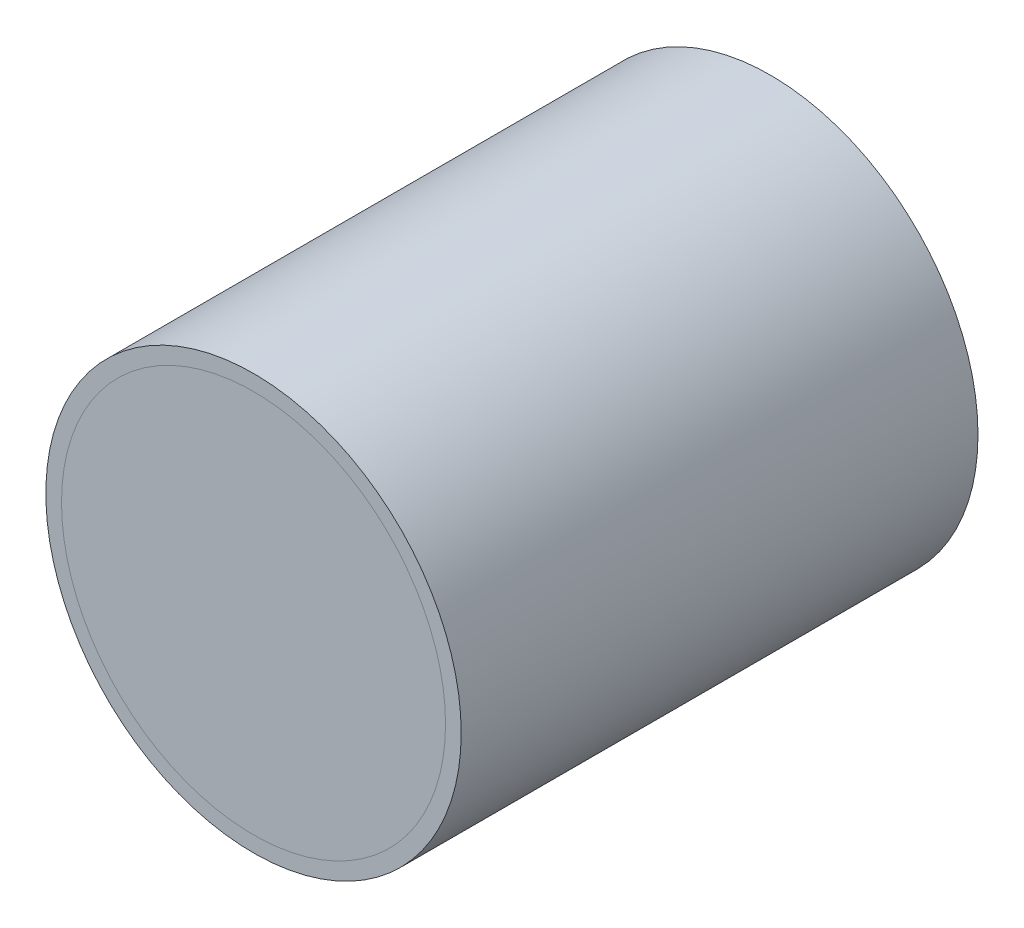
from build123d import *

# Parameters (mm, degrees)
SKETCH1_R           = 7.747
SKETCH1_R_2         = 7.1628
BOSS_EXTRUDE1_DEPTH = 19.2786
SKETCH2_R           = 7.1628
BOSS_EXTRUDE2_DEPTH = 19.2786


with BuildPart() as part:
    # Sketch1 → Boss-Extrude1 (new body)
    with BuildSketch(Plane.XY):
        Circle(SKETCH1_R)
        Circle(SKETCH1_R_2, mode=Mode.SUBTRACT)
    extrude(amount=BOSS_EXTRUDE1_DEPTH)


with BuildPart() as body_2:
    # Sketch2 → Boss-Extrude2 (new body)
    with BuildSketch(Plane.XY):
        Circle(SKETCH2_R)
    extrude(amount=BOSS_EXTRUDE2_DEPTH)


solid = Compound([part.part, body_2.part])
